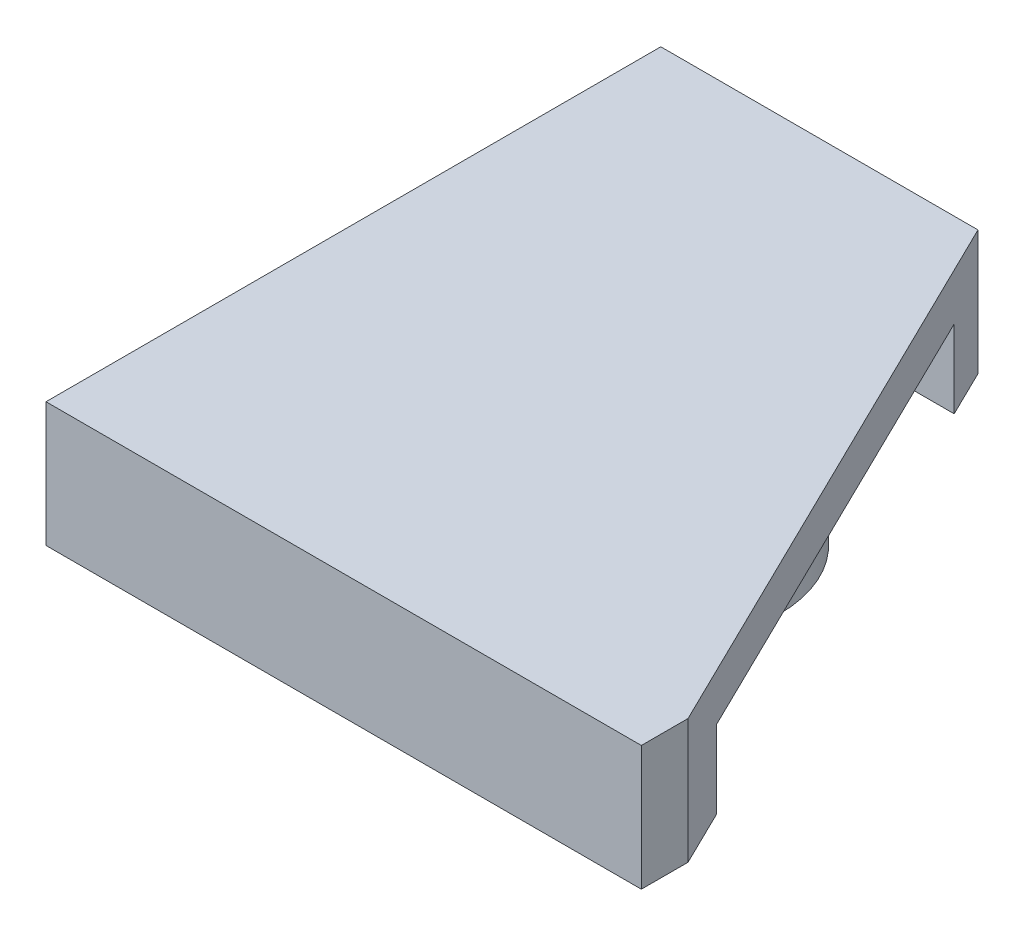
from build123d import *

# Parameters (mm, degrees)
MAINBASESKETCH_W          = 15.8
MAINBASESKETCH_H          = 3.2
MAINBASEEXTRUDE_DEPTH     = 7.9
MAINBASESHELL_T           = -1.2
UNDERSIDECIRCLEEXT_START  = -0.2
UNDERSIDECIRCLESKETCH_R   = 3.05
UNDERSIDECIRCLESKETCH_R_2 = 2.4
UNDERSIDECIRCLEEXT_DEPTH  = 2.2
SECONDANGLEDCUT_DEPTH     = 19.555463972
SECONDNOTCH_DEPTH         = 2.2


with BuildPart() as part:
    # MainBaseSketch → MainBaseExtrude (new, symmetric)
    with BuildSketch(Plane.XY):
        with Locations((8.581967213, 1.6)):
            Rectangle(MAINBASESKETCH_W, MAINBASESKETCH_H)
    extrude(amount=MAINBASEEXTRUDE_DEPTH, both=True)

    # MainBaseShell
    mainbaseshell_openings = [part.faces().sort_by_distance(p)[0] for p in [
        (8.581967213, 0, 0),
    ]]
    offset(amount=MAINBASESHELL_T, openings=mainbaseshell_openings, kind=Kind.INTERSECTION)

    # UnderSideCircleSketch → UnderSideCircleExt (add)
    with BuildSketch(Plane.XZ.offset(-2).offset(UNDERSIDECIRCLEEXT_START)):
        with Locations((8.581967213, 0)):
            Circle(UNDERSIDECIRCLESKETCH_R)
        with Locations((8.581967213, 0)):
            Circle(UNDERSIDECIRCLESKETCH_R_2, mode=Mode.SUBTRACT)
    extrude(amount=UNDERSIDECIRCLEEXT_DEPTH)

    # Sketch53 → SecondAngledCut (cut, through all)
    with BuildSketch(Plane(origin=(0, 0, 0), x_dir=(-1, 0, 0), z_dir=(0, -1, 0))):
        Polygon((-8.833667893, 7.9), (-15.981967213, -6.7), (-15.981967213, -7.9), (-16.481967213, -7.9), (-16.481967213, 7.9), align=None)
    extrude(amount=-SECONDANGLEDCUT_DEPTH, mode=Mode.SUBTRACT)

    # Sketch56 → SecondNotch (cut)
    with BuildSketch(Plane(origin=(0, 0, 0), x_dir=(-1, 0, 0), z_dir=(0, -1, 0))):
        with BuildLine():
            Line((-10.711153505, 3.699172992), (-11.897271127, 1.358994981))
            ThreePointArc((-11.897271127, 1.358994981), (-11.034832221, 2.39254887), (-10.711153505, 3.699172992))
        make_face()
    extrude(amount=-SECONDNOTCH_DEPTH, mode=Mode.SUBTRACT)


solid = part.part
